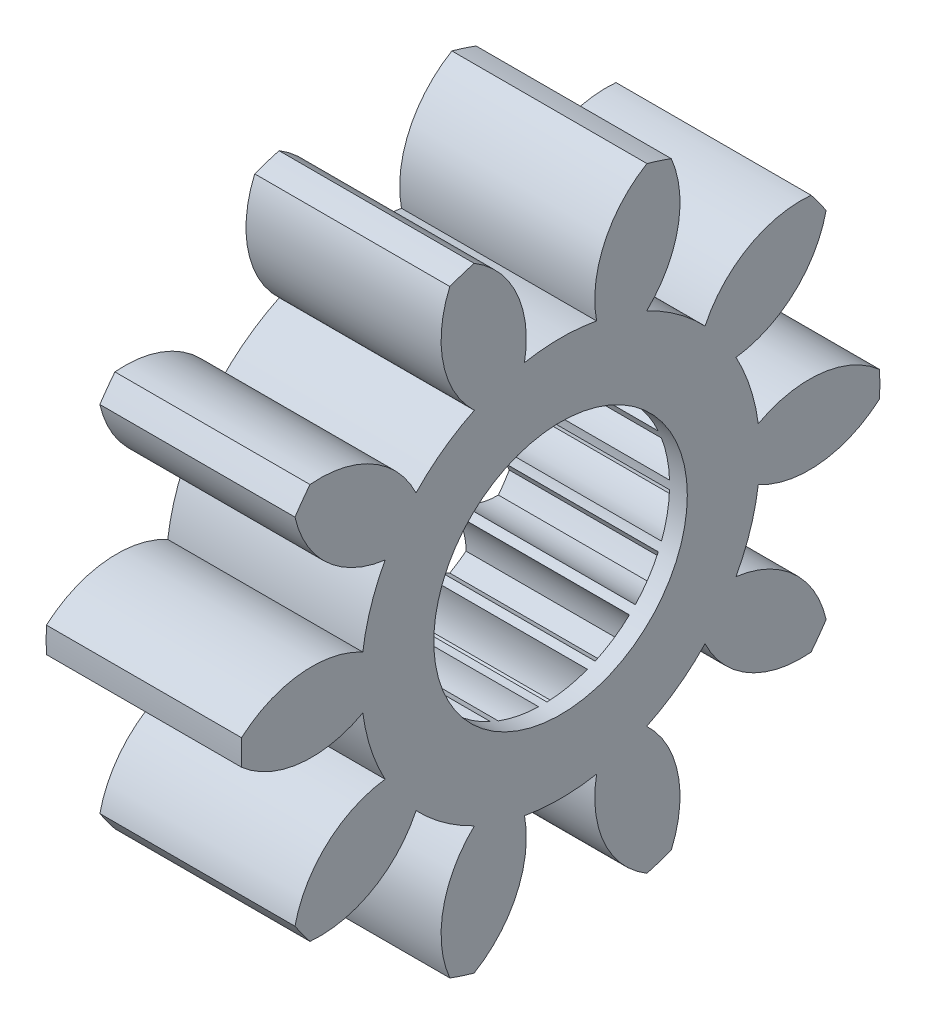
from build123d import *
from build123d.topology import SkipClean

# Parameters (mm, degrees)
BASPROSKE_W                  = 5
BASPROSKE_H                  = 9
TOOTHCUT_DEPTH               = 14.674794331
TEETHCUTS_COUNT              = 10
TEETHCUTS_ANGLE              = 324
BORSKE_R                     = 1
BORE_DEPTH                   = 50.0000508
TAGLIO_ESTRUSIONE1_DEPTH     = 14.456084477
ESTRUSIONE_ESTRUSIONE1_START = 0.5
SCHIZZO2_R                   = 5.624
SCHIZZO2_R_2                 = 3.574
ESTRUSIONE_ESTRUSIONE1_DEPTH = 0.5
ESTRUSIONE_ESTRUSIONE2_DEPTH = 0.5


with BuildPart() as part:
    # BasProSke → Base-Revolve (revolve)
    with BuildSketch(Plane(origin=(0, 0, 0), x_dir=(1, 0, 0), z_dir=(0, 1, 0)), mode=Mode.PRIVATE) as base_revolve_sk:
        with Locations((2.5, 4.5)):
            Rectangle(BASPROSKE_W, BASPROSKE_H)
    revolve(base_revolve_sk.sketch.rotate(Axis((-10, 0, 0), (1, 0, 0)), 180), axis=Axis((-10, 0, 0), (1, 0, 0)))

    # TooCutSke → ToothCut (cut, through all)
    with BuildSketch(Plane(origin=(0, 0, 0), x_dir=(0, 0, -1), z_dir=(1, 0, 0))):
        with BuildLine():
            ThreePointArc((1.016107861, 5.531446539), (0, 5.624), (-1.016107861, 5.531446539))
            ThreePointArc((-1.016107861, 5.531446539), (-1.239855704, 7.337466374), (-2.46637752, 8.681867719))
            ThreePointArc((-2.46637752, 8.681867719), (0, 9.0254), (2.46637752, 8.681867719))
            ThreePointArc((2.46637752, 8.681867719), (1.239855704, 7.337466374), (1.016107861, 5.531446539))
        make_face()
    toothcut = extrude(amount=TOOTHCUT_DEPTH, mode=Mode.SUBTRACT)

    # TeethCuts: ToothCut ×10 about axis
    teethcuts_axis = Axis((-10, 0, 0), (1, 0, 0))
    for i in range(1, TEETHCUTS_COUNT):
        add(toothcut.rotate(teethcuts_axis, i * TEETHCUTS_ANGLE / (TEETHCUTS_COUNT - 1)), mode=Mode.SUBTRACT)

    # BorSke → Bore (cut, symmetric)
    with BuildSketch(Plane(origin=(0, 0, 0), x_dir=(0, 0, -1), z_dir=(1, 0, 0))):
        with Locations(Location((0, 0, 0), (0, 0, 180))):
            Circle(BORSKE_R)
    extrude(amount=BORE_DEPTH, both=True, mode=Mode.SUBTRACT)

    # Schizzo1 → Taglio-Estrusione1 (cut, through all)
    with BuildSketch(Plane(origin=(5, 0, 0), x_dir=(0, 0, -1), z_dir=(1, 0, 0))):
        with BuildLine():
            ThreePointArc((-0.117245432, 3.572076358), (-0.287738258, 4.159283684), (-0.644969227, 4.655535919))
            ThreePointArc((-0.644969227, 4.655535919), (-0.916924513, 4.609690818), (-1.185722597, 4.547973386))
            ThreePointArc((-1.185722597, 4.547973386), (-1.325853469, 3.952789729), (-1.258653786, 3.34503612))
            ThreePointArc((-1.258653786, 3.34503612), (-1.367710587, 3.301945449), (-1.475295097, 3.255300351))
            ThreePointArc((-1.475295097, 3.255300351), (-1.857524443, 3.732564401), (-2.377470333, 4.054335311))
            ThreePointArc((-2.377470333, 4.054335311), (-2.611180095, 3.907907178), (-2.835898905, 3.748023133))
            ThreePointArc((-2.835898905, 3.748023133), (-2.737596024, 3.144519371), (-2.442934375, 2.608744456))
            ThreePointArc((-2.442934375, 2.608744456), (-2.527199636, 2.527199636), (-2.608744456, 2.442934375))
            ThreePointArc((-2.608744456, 2.442934375), (-3.144519371, 2.737596024), (-3.748023133, 2.835898905))
            ThreePointArc((-3.748023133, 2.835898905), (-3.907907178, 2.611180095), (-4.054335311, 2.377470333))
            ThreePointArc((-4.054335311, 2.377470333), (-3.732564401, 1.857524443), (-3.255300351, 1.475295097))
            ThreePointArc((-3.255300351, 1.475295097), (-3.301945449, 1.367710587), (-3.34503612, 1.258653786))
            ThreePointArc((-3.34503612, 1.258653786), (-3.952789729, 1.325853469), (-4.547973386, 1.185722597))
            ThreePointArc((-4.547973386, 1.185722597), (-4.609690818, 0.916924513), (-4.655535919, 0.644969227))
            ThreePointArc((-4.655535919, 0.644969227), (-4.159283684, 0.287738258), (-3.572076358, 0.117245432))
            ThreePointArc((-3.572076358, 0.117245432), (-3.574, 0), (-3.572076358, -0.117245432))
            ThreePointArc((-3.572076358, -0.117245432), (-4.159283684, -0.287738258), (-4.655535919, -0.644969227))
            ThreePointArc((-4.655535919, -0.644969227), (-4.609690818, -0.916924513), (-4.547973386, -1.185722597))
            ThreePointArc((-4.547973386, -1.185722597), (-3.952789729, -1.325853469), (-3.34503612, -1.258653786))
            ThreePointArc((-3.34503612, -1.258653786), (-3.301945449, -1.367710587), (-3.255300351, -1.475295097))
            ThreePointArc((-3.255300351, -1.475295097), (-3.732564401, -1.857524443), (-4.054335311, -2.377470333))
            ThreePointArc((-4.054335311, -2.377470333), (-3.907907178, -2.611180095), (-3.748023133, -2.835898905))
            ThreePointArc((-3.748023133, -2.835898905), (-3.144519371, -2.737596024), (-2.608744456, -2.442934375))
            ThreePointArc((-2.608744456, -2.442934375), (-2.527199636, -2.527199636), (-2.442934375, -2.608744456))
            ThreePointArc((-2.442934375, -2.608744456), (-2.737596024, -3.144519371), (-2.835898905, -3.748023133))
            ThreePointArc((-2.835898905, -3.748023133), (-2.611180095, -3.907907178), (-2.377470333, -4.054335311))
            ThreePointArc((-2.377470333, -4.054335311), (-1.857524443, -3.732564401), (-1.475295097, -3.255300351))
            ThreePointArc((-1.475295097, -3.255300351), (-1.367710587, -3.301945449), (-1.258653786, -3.34503612))
            ThreePointArc((-1.258653786, -3.34503612), (-1.325853469, -3.952789729), (-1.185722597, -4.547973386))
            ThreePointArc((-1.185722597, -4.547973386), (-0.916924513, -4.609690818), (-0.644969227, -4.655535919))
            ThreePointArc((-0.644969227, -4.655535919), (-0.287738258, -4.159283684), (-0.117245432, -3.572076358))
            ThreePointArc((-0.117245432, -3.572076358), (0, -3.574), (0.117245432, -3.572076358))
            ThreePointArc((0.117245432, -3.572076358), (0.287738258, -4.159283684), (0.644969227, -4.655535919))
            ThreePointArc((0.644969227, -4.655535919), (0.916924513, -4.609690818), (1.185722597, -4.547973386))
            ThreePointArc((1.185722597, -4.547973386), (1.325853469, -3.952789729), (1.258653786, -3.34503612))
            ThreePointArc((1.258653786, -3.34503612), (1.367710587, -3.301945449), (1.475295097, -3.255300351))
            ThreePointArc((1.475295097, -3.255300351), (1.857524443, -3.732564401), (2.377470333, -4.054335311))
            ThreePointArc((2.377470333, -4.054335311), (2.611180095, -3.907907178), (2.835898905, -3.748023133))
            ThreePointArc((2.835898905, -3.748023133), (2.737596024, -3.144519371), (2.442934375, -2.608744456))
            ThreePointArc((2.442934375, -2.608744456), (2.527199636, -2.527199636), (2.608744456, -2.442934375))
            ThreePointArc((2.608744456, -2.442934375), (3.144519371, -2.737596024), (3.748023133, -2.835898905))
            ThreePointArc((3.748023133, -2.835898905), (3.907907178, -2.611180095), (4.054335311, -2.377470333))
            ThreePointArc((4.054335311, -2.377470333), (3.732564401, -1.857524443), (3.255300351, -1.475295097))
            ThreePointArc((3.255300351, -1.475295097), (3.301945449, -1.367710587), (3.34503612, -1.258653786))
            ThreePointArc((3.34503612, -1.258653786), (3.952789729, -1.325853469), (4.547973386, -1.185722597))
            ThreePointArc((4.547973386, -1.185722597), (4.609690818, -0.916924513), (4.655535919, -0.644969227))
            ThreePointArc((4.655535919, -0.644969227), (4.159283684, -0.287738258), (3.572076358, -0.117245432))
            ThreePointArc((3.572076358, -0.117245432), (3.574, 0), (3.572076358, 0.117245432))
            ThreePointArc((3.572076358, 0.117245432), (4.159283684, 0.287738258), (4.655535919, 0.644969227))
            ThreePointArc((4.655535919, 0.644969227), (4.609690818, 0.916924513), (4.547973386, 1.185722597))
            ThreePointArc((4.547973386, 1.185722597), (3.952789729, 1.325853469), (3.34503612, 1.258653786))
            ThreePointArc((3.34503612, 1.258653786), (3.301945449, 1.367710587), (3.255300351, 1.475295097))
            ThreePointArc((3.255300351, 1.475295097), (3.732564401, 1.857524443), (4.054335311, 2.377470333))
            ThreePointArc((4.054335311, 2.377470333), (3.907907178, 2.611180095), (3.748023133, 2.835898905))
            ThreePointArc((3.748023133, 2.835898905), (3.144519371, 2.737596024), (2.608744456, 2.442934375))
            ThreePointArc((2.608744456, 2.442934375), (2.527199636, 2.527199636), (2.442934375, 2.608744456))
            ThreePointArc((2.442934375, 2.608744456), (2.737596024, 3.144519371), (2.835898905, 3.748023133))
            ThreePointArc((2.835898905, 3.748023133), (2.611180095, 3.907907178), (2.377470333, 4.054335311))
            ThreePointArc((2.377470333, 4.054335311), (1.857524443, 3.732564401), (1.475295097, 3.255300351))
            ThreePointArc((1.475295097, 3.255300351), (1.367710587, 3.301945449), (1.258653786, 3.34503612))
            ThreePointArc((1.258653786, 3.34503612), (1.325853469, 3.952789729), (1.185722597, 4.547973386))
            ThreePointArc((1.185722597, 4.547973386), (0.916924513, 4.609690818), (0.644969227, 4.655535919))
            ThreePointArc((0.644969227, 4.655535919), (0.287738258, 4.159283684), (0.117245432, 3.572076358))
            ThreePointArc((0.117245432, 3.572076358), (0, 3.574), (-0.117245432, 3.572076358))
        make_face()
    extrude(amount=-TAGLIO_ESTRUSIONE1_DEPTH, mode=Mode.SUBTRACT)

    # Schizzo2 → Estrusione-Estrusione1 (add)
    with SkipClean():  # the faces are left unmerged after this step: merging them gives an invalid solid
        with BuildSketch(Plane(origin=(5, 0, 0), x_dir=(0, 0, -1), z_dir=(1, 0, 0)).offset(ESTRUSIONE_ESTRUSIONE1_START)):
            with Locations(Location((0, 0, 0), (0, 0, 172.408992725))):
                Circle(SCHIZZO2_R)
            Circle(SCHIZZO2_R_2, mode=Mode.SUBTRACT)
        extrude(amount=-ESTRUSIONE_ESTRUSIONE1_DEPTH)

    # Schizzo3 → Estrusione-Estrusione2 (add)
    with BuildSketch(Plane(origin=(5, 0, 0), x_dir=(0, 0, -1), z_dir=(1, 0, 0))):
        with BuildLine():
            ThreePointArc((2.429254172, 5.072287469), (1.737911576, 5.348741848), (1.016107861, 5.531446539))
            ThreePointArc((1.016107861, 5.531446539), (1.232530888, 7.321430802), (2.435937301, 8.6640758))
            ThreePointArc((2.435937301, 8.6640758), (2.781152949, 8.559508647), (3.121901306, 8.441192584))
            ThreePointArc((3.121901306, 8.441192584), (3.306290616, 6.647625421), (2.429254172, 5.072287469))
        make_face()
        with BuildLine():
            ThreePointArc((-1.016107861, 5.531446539), (-1.737911576, 5.348741848), (-2.429254172, 5.072287469))
            ThreePointArc((-2.429254172, 5.072287469), (-3.306290616, 6.647625421), (-3.121901306, 8.441192584))
            ThreePointArc((-3.121901306, 8.441192584), (-2.781152949, 8.559508647), (-2.435937301, 8.6640758))
            ThreePointArc((-2.435937301, 8.6640758), (-1.232530888, 7.321430802), (-1.016107861, 5.531446539))
        make_face()
        with BuildLine():
            ThreePointArc((-4.073351227, 3.877781038), (-4.549911576, 3.305704259), (-4.946723679, 2.675686986))
            ThreePointArc((-4.946723679, 2.675686986), (-6.582221482, 3.434653073), (-7.487279724, 4.994060706))
            ThreePointArc((-7.487279724, 4.994060706), (-7.281152949, 5.290067271), (-7.063330654, 5.577576542))
            ThreePointArc((-7.063330654, 5.577576542), (-5.300567485, 5.198698463), (-4.073351227, 3.877781038))
        make_face()
        with BuildLine():
            ThreePointArc((-5.574712873, 0.742934982), (-5.624, 0), (-5.574712873, -0.742934982))
            ThreePointArc((-5.574712873, -0.742934982), (-7.343967463, -1.090240008), (-8.99277177, -0.360632619))
            ThreePointArc((-8.99277177, -0.360632619), (-9, 0), (-8.99277177, 0.360632619))
            ThreePointArc((-8.99277177, 0.360632619), (-7.343967463, 1.090240008), (-5.574712873, 0.742934982))
        make_face()
        with BuildLine():
            ThreePointArc((-4.946723679, -2.675686986), (-4.549911576, -3.305704259), (-4.073351227, -3.877781038))
            ThreePointArc((-4.073351227, -3.877781038), (-5.300567485, -5.198698463), (-7.063330654, -5.577576542))
            ThreePointArc((-7.063330654, -5.577576542), (-7.281152949, -5.290067271), (-7.487279724, -4.994060706))
            ThreePointArc((-7.487279724, -4.994060706), (-6.582221482, -3.434653073), (-4.946723679, -2.675686986))
        make_face()
        with BuildLine():
            ThreePointArc((-2.429254172, -5.072287469), (-1.737911576, -5.348741848), (-1.016107861, -5.531446539))
            ThreePointArc((-1.016107861, -5.531446539), (-1.232530888, -7.321430802), (-2.435937301, -8.6640758))
            ThreePointArc((-2.435937301, -8.6640758), (-2.781152949, -8.559508647), (-3.121901306, -8.441192584))
            ThreePointArc((-3.121901306, -8.441192584), (-3.306290616, -6.647625421), (-2.429254172, -5.072287469))
        make_face()
        with BuildLine():
            ThreePointArc((1.016107861, -5.531446539), (1.737911576, -5.348741848), (2.429254172, -5.072287469))
            ThreePointArc((2.429254172, -5.072287469), (3.306290616, -6.647625421), (3.121901306, -8.441192584))
            ThreePointArc((3.121901306, -8.441192584), (2.781152949, -8.559508647), (2.435937301, -8.6640758))
            ThreePointArc((2.435937301, -8.6640758), (1.232530888, -7.321430802), (1.016107861, -5.531446539))
        make_face()
        with BuildLine():
            ThreePointArc((4.073351227, -3.877781038), (4.549911576, -3.305704259), (4.946723679, -2.675686986))
            ThreePointArc((4.946723679, -2.675686986), (6.582221482, -3.434653073), (7.487279724, -4.994060706))
            ThreePointArc((7.487279724, -4.994060706), (7.281152949, -5.290067271), (7.063330654, -5.577576542))
            ThreePointArc((7.063330654, -5.577576542), (5.300567485, -5.198698463), (4.073351227, -3.877781038))
        make_face()
        with BuildLine():
            ThreePointArc((5.574712873, -0.742934982), (5.624, 0), (5.574712873, 0.742934982))
            ThreePointArc((5.574712873, 0.742934982), (7.343967463, 1.090240008), (8.99277177, 0.360632619))
            ThreePointArc((8.99277177, 0.360632619), (9, 0), (8.99277177, -0.360632619))
            ThreePointArc((8.99277177, -0.360632619), (7.343967463, -1.090240008), (5.574712873, -0.742934982))
        make_face()
        with BuildLine():
            ThreePointArc((4.946723679, 2.675686986), (4.549911576, 3.305704259), (4.073351227, 3.877781038))
            ThreePointArc((4.073351227, 3.877781038), (5.300567485, 5.198698463), (7.063330654, 5.577576542))
            ThreePointArc((7.063330654, 5.577576542), (7.281152949, 5.290067271), (7.487279724, 4.994060706))
            ThreePointArc((7.487279724, 4.994060706), (6.582221482, 3.434653073), (4.946723679, 2.675686986))
        make_face()
    extrude(amount=ESTRUSIONE_ESTRUSIONE2_DEPTH)


solid = part.part
